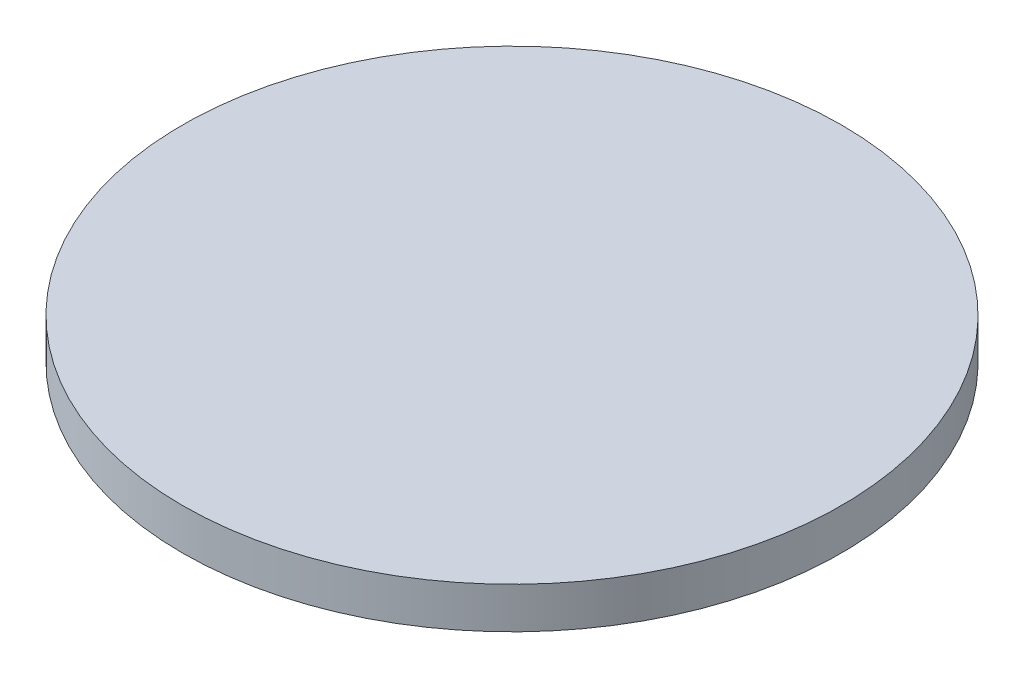
from build123d import *

# Parameters (mm, degrees)
PRESS_POSET_KELEPCESI_D320_START = 1770
SKETCH1_R                        = 160
PRESS_POSET_KELEPCESI_D320_DEPTH = 20


with BuildPart() as part:
    # Sketch1 → PRESS_poset_kelepcesi_D320 (new body)
    with BuildSketch(Plane(origin=(0, 0, 0), x_dir=(1, 0, 0), z_dir=(0, 1, 0)).offset(PRESS_POSET_KELEPCESI_D320_START)):
        with Locations(Location((185, 300, 0), (0, 0, 270))):
            Circle(SKETCH1_R)
    extrude(amount=PRESS_POSET_KELEPCESI_D320_DEPTH)


solid = part.part
